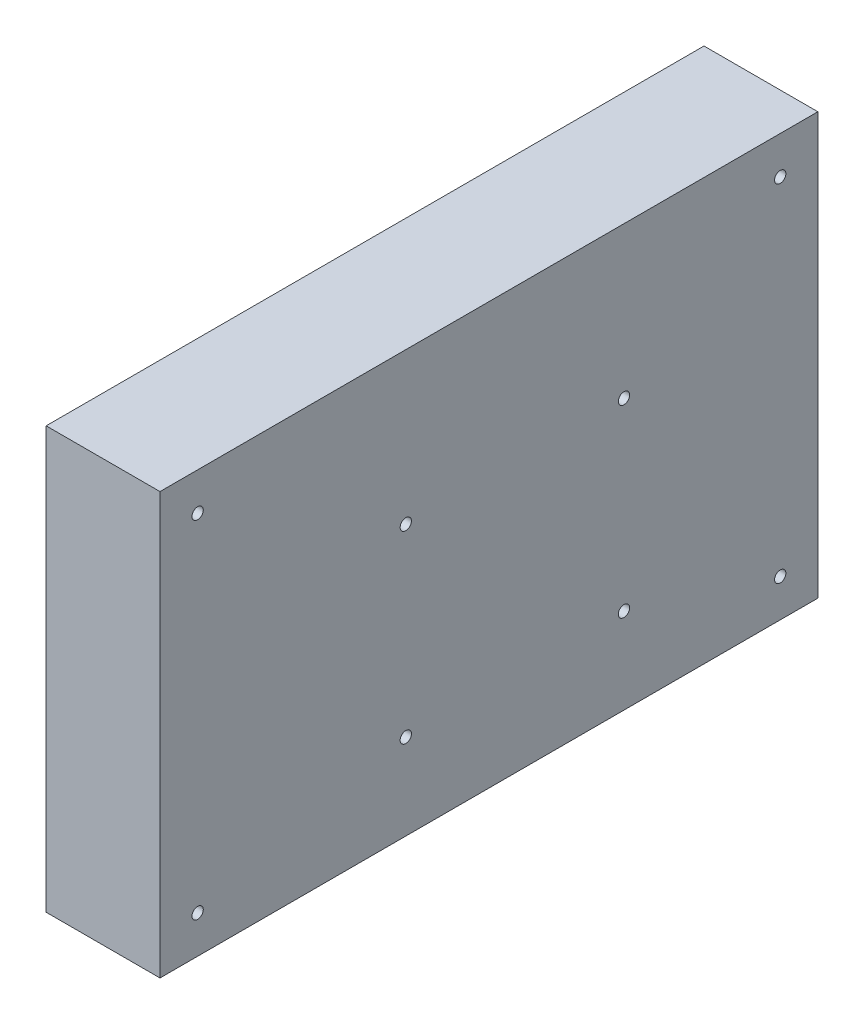
from build123d import *

# Parameters (mm, degrees)
CROQUIS1_W              = 164.9
CROQUIS1_H              = 102
SALIENTE_EXTRUIR2_DEPTH = 14.27
CROQUIS2_W              = 174.9
CROQUIS2_H              = 112
CROQUIS2_W_2            = 166.9
CROQUIS2_H_2            = 104
SALIENTE_EXTRUIR3_DEPTH = 14.27
CROQUIS3_W              = 174.9
CROQUIS3_H              = 112
CROQUIS3_W_2            = 160.9
CROQUIS3_H_2            = 98.374406292
SALIENTE_EXTRUIR5_DEPTH = 1
CROQUIS4_W              = 164.9
CROQUIS4_H              = 102
CORTAR_EXTRUIR2_DEPTH   = 14.27
CROQUIS6_W              = 174.9
CROQUIS6_H              = 112
CROQUIS6_R              = 1.5
SALIENTE_EXTRUIR6_DEPTH = 15
CROQUIS8_W              = 160.9
CROQUIS8_H              = 98.374406292
CORTAR_EXTRUIR3_DEPTH   = 9
CROQUIS9_W              = 166.9
CROQUIS9_H              = 104
CORTAR_EXTRUIR5_DEPTH   = 11


with BuildPart() as part:
    # Croquis1 → Saliente-Extruir2 (new body)
    with BuildSketch(Plane(origin=(0, 0, 0), x_dir=(0, 0, -1), z_dir=(1, 0, 0))):
        Rectangle(CROQUIS1_W, CROQUIS1_H)
    extrude(amount=SALIENTE_EXTRUIR2_DEPTH)

    # Croquis4 → Cortar-Extruir2 (cut)
    with BuildSketch(Plane(origin=(14.27, 0, 0), x_dir=(0, 0, -1), z_dir=(1, 0, 0))):
        Rectangle(CROQUIS4_W, CROQUIS4_H)
    extrude(amount=-CORTAR_EXTRUIR2_DEPTH, mode=Mode.SUBTRACT)


with BuildPart() as body_2:
    # Croquis2 → Saliente-Extruir3 (new body)
    with BuildSketch(Plane(origin=(0, 0, 0), x_dir=(0, 0, -1), z_dir=(1, 0, 0))):
        Rectangle(CROQUIS2_W, CROQUIS2_H)
        Rectangle(CROQUIS2_W_2, CROQUIS2_H_2, mode=Mode.SUBTRACT)
    extrude(amount=SALIENTE_EXTRUIR3_DEPTH)

    # Croquis3 → Saliente-Extruir5 (add)
    with BuildSketch(Plane.ZY):
        Rectangle(CROQUIS3_W, CROQUIS3_H)
        with Locations((0, -0.062203146)):
            Rectangle(CROQUIS3_W_2, CROQUIS3_H_2, mode=Mode.SUBTRACT)
    extrude(amount=SALIENTE_EXTRUIR5_DEPTH)

    # Croquis6 → Saliente-Extruir6 (add)
    with BuildSketch(Plane(origin=(14.27, 0, 0), x_dir=(0, 0, -1), z_dir=(1, 0, 0))):
        Rectangle(CROQUIS6_W, CROQUIS6_H)
        with Locations((-77.445, 46)):
            Circle(CROQUIS6_R, mode=Mode.SUBTRACT)
        with Locations((-77.445, -46)):
            Circle(CROQUIS6_R, mode=Mode.SUBTRACT)
        with Locations((-22.1, 15.81)):
            Circle(CROQUIS6_R, mode=Mode.SUBTRACT)
        with Locations((35.9, 15.81)):
            Circle(CROQUIS6_R, mode=Mode.SUBTRACT)
        with Locations((-22.1, -33.19)):
            Circle(CROQUIS6_R, mode=Mode.SUBTRACT)
        with Locations((35.9, -33.19)):
            Circle(CROQUIS6_R, mode=Mode.SUBTRACT)
        with Locations((77.445, 46)):
            Circle(CROQUIS6_R, mode=Mode.SUBTRACT)
        with Locations((77.445, -46)):
            Circle(CROQUIS6_R, mode=Mode.SUBTRACT)
    extrude(amount=SALIENTE_EXTRUIR6_DEPTH)

    # Croquis8 → Cortar-Extruir3 (cut)
    with BuildSketch(Plane.ZY.offset(-14.27)):
        with Locations((0, -0.062203146)):
            Rectangle(CROQUIS8_W, CROQUIS8_H)
    extrude(amount=-CORTAR_EXTRUIR3_DEPTH, mode=Mode.SUBTRACT)

    # Croquis9 → Cortar-Extruir5 (cut)
    with BuildSketch(Plane.ZY.offset(-14.27)):
        Rectangle(CROQUIS9_W, CROQUIS9_H)
    extrude(amount=-CORTAR_EXTRUIR5_DEPTH, mode=Mode.SUBTRACT)


solid = body_2.part
